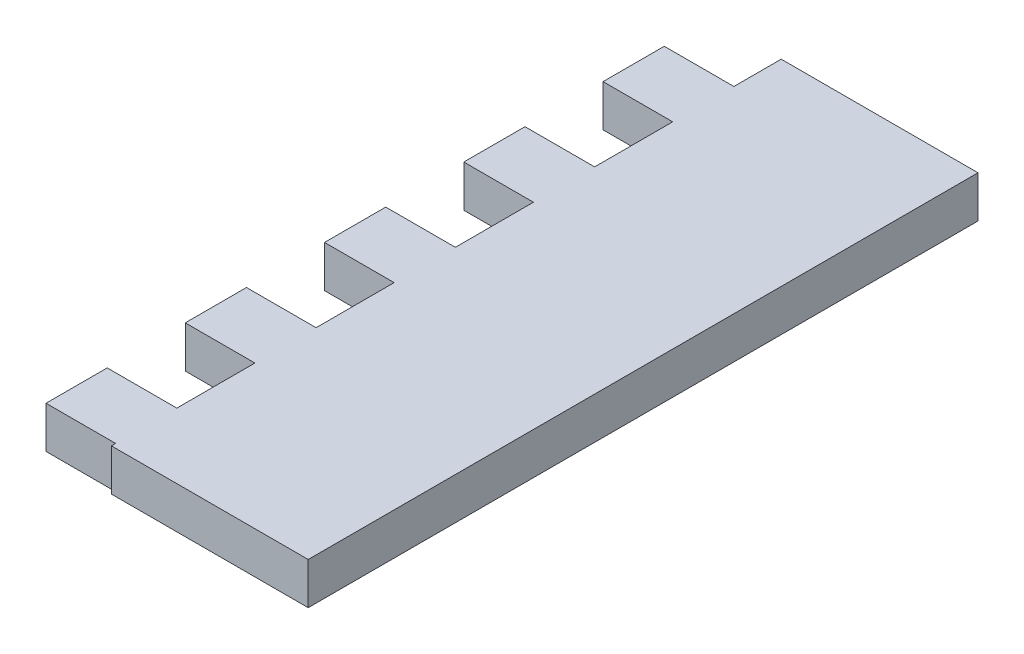
from build123d import *

# Parameters (mm, degrees)
SKETCH_1_W          = 19.1304083
SKETCH_1_H          = 50
EXTRUDE_1_DEPTH     = 3
SKETCH_2_W          = 5
SKETCH_2_H          = 5
CUT_EXTRUDE_1_DEPTH = 3
SKETCH_3_W          = 18.086961025
SKETCH_3_H          = 4.686767273
CUT_EXTRUDE_2_DEPTH = 3
SKETCH_4_W          = 5
SKETCH_4_H          = 0.605391548
CUT_EXTRUDE_3_DEPTH = 10


with BuildPart() as part:
    # 草图1 → 凸台-拉伸1 (new body)
    with BuildSketch(Plane(origin=(0, 0, 0), x_dir=(1, 0, 0), z_dir=(0, 1, 0))):
        Rectangle(SKETCH_1_W, SKETCH_1_H)
    extrude(amount=EXTRUDE_1_DEPTH)

    # 草图2 → 切除-拉伸1 (cut)
    with BuildSketch(Plane(origin=(0, 3, 0), x_dir=(1, 0, 0), z_dir=(0, 1, 0))):
        with Locations((-7.06520415, 12.5)):
            Rectangle(SKETCH_2_W, SKETCH_2_H)
        with Locations((-7.06520415, 22.5)):
            Rectangle(SKETCH_2_W, SKETCH_2_H)
        with Locations((-7.06520415, 2.5)):
            Rectangle(SKETCH_2_W, SKETCH_2_H)
        with Locations((-7.06520415, -7.5)):
            Rectangle(SKETCH_2_W, SKETCH_2_H)
        with Locations((-7.06520415, -17.5)):
            Rectangle(SKETCH_2_W, SKETCH_2_H)
    extrude(amount=-CUT_EXTRUDE_1_DEPTH, mode=Mode.SUBTRACT)

    # 草图3 → 切除-拉伸2 (cut)
    with BuildSketch(Plane(origin=(0, 3, 0), x_dir=(1, 0, 0), z_dir=(0, 1, 0))):
        with Locations((3.01992157, 25.438245622)):
            Rectangle(SKETCH_3_W, SKETCH_3_H)
    extrude(amount=-CUT_EXTRUDE_2_DEPTH, mode=Mode.SUBTRACT)

    # 草图4 → 切除-拉伸3 (cut)
    with BuildSketch(Plane(origin=(0, 3, 0), x_dir=(1, 0, 0), z_dir=(0, 1, 0))):
        with Locations((-7.06520415, 20)):
            Rectangle(SKETCH_4_W, SKETCH_4_H)
        with Locations((-7.06520415, 15)):
            Rectangle(SKETCH_4_W, SKETCH_4_H)
        with Locations((-7.06520415, 5)):
            Rectangle(SKETCH_4_W, SKETCH_4_H)
        with Locations((-7.06520415, 10)):
            Rectangle(SKETCH_4_W, SKETCH_4_H)
        with Locations((-7.06520415, -5)):
            Rectangle(SKETCH_4_W, SKETCH_4_H)
        with Locations((-7.06520415, 0)):
            Rectangle(SKETCH_4_W, SKETCH_4_H)
        with Locations((-7.06520415, -15)):
            Rectangle(SKETCH_4_W, SKETCH_4_H)
        with Locations((-7.06520415, -10)):
            Rectangle(SKETCH_4_W, SKETCH_4_H)
        with Locations((-7.06520415, -25)):
            Rectangle(SKETCH_4_W, SKETCH_4_H)
        with Locations((-7.06520415, -20)):
            Rectangle(SKETCH_4_W, SKETCH_4_H)
    extrude(amount=-CUT_EXTRUDE_3_DEPTH, mode=Mode.SUBTRACT)


solid = part.part
